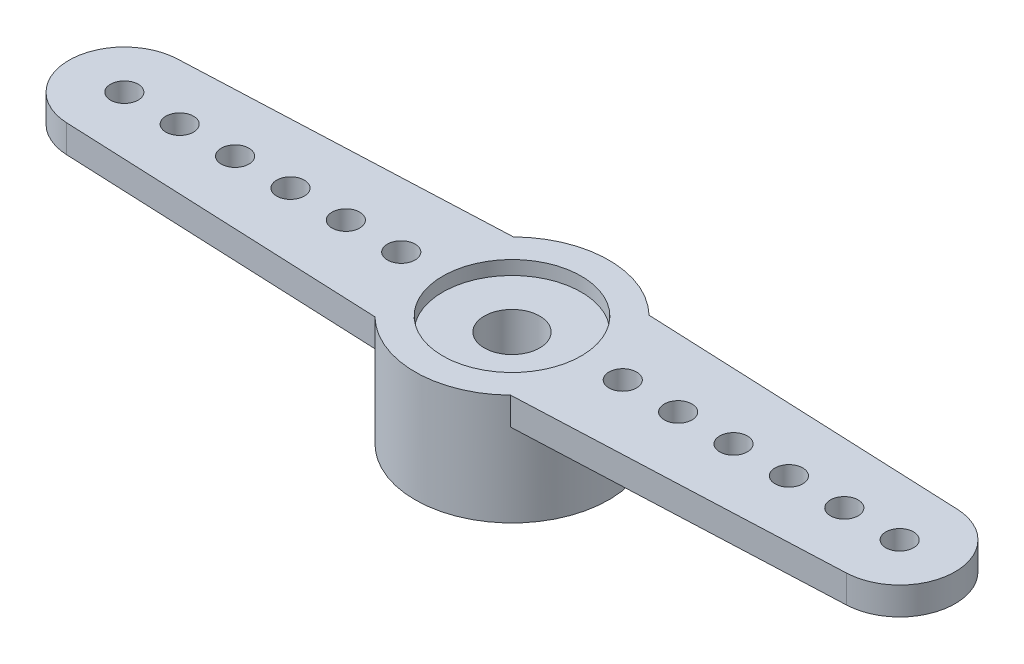
from build123d import *

# Parameters (mm, degrees)
SKETCH1_R           = 3.5
SKETCH1_R_2         = 2.5
BOSS_EXTRUDE1_DEPTH = 4
BOSS_EXTRUDE2_START = -2
SKETCH2_R           = 3.5
SKETCH2_R_2         = 1
BOSS_EXTRUDE2_DEPTH = 1.5
BOSS_EXTRUDE3_START = -1
BOSS_EXTRUDE3_DEPTH = 1
CUT_EXTRUDE1_REACH  = 18.86
SKETCH4_R           = 0.5


with BuildPart() as part:
    # Sketch1 → Boss-Extrude1 (new body)
    with BuildSketch(Plane(origin=(0, 0, 0), x_dir=(1, 0, 0), z_dir=(0, 1, 0))):
        with Locations(Location((0, 0, 0), (0, 0, 270))):
            Circle(SKETCH1_R)
        with Locations(Location((0, 0, 0), (0, 0, 270))):
            Circle(SKETCH1_R_2, mode=Mode.SUBTRACT)
    extrude(amount=BOSS_EXTRUDE1_DEPTH)

    # Sketch2 → Boss-Extrude2 (add)
    with BuildSketch(Plane(origin=(0, 4, 0), x_dir=(1, 0, 0), z_dir=(0, 1, 0)).offset(BOSS_EXTRUDE2_START)):
        with Locations(Location((0, 0, 0), (0, 0, 270))):
            Circle(SKETCH2_R)
        with Locations(Location((0, 0, 0), (0, 0, 270))):
            Circle(SKETCH2_R_2, mode=Mode.SUBTRACT)
    extrude(amount=BOSS_EXTRUDE2_DEPTH)

    # Sketch3 → Boss-Extrude3 (add)
    with BuildSketch(Plane(origin=(0, 4, 0), x_dir=(1, 0, 0), z_dir=(0, 1, 0)).offset(BOSS_EXTRUDE3_START)):
        with BuildLine():
            ThreePointArc((-2.449489743, -2.5), (-3.5, 0), (-2.449489743, 2.5))
            Line((-2.449489743, 2.5), (-14.086174253, 1.998142637))
            ThreePointArc((-14.086174253, 1.998142637), (-16, 0), (-14.086174253, -1.998142637))
            Line((-14.086174253, -1.998142637), (-2.449489743, -2.5))
        make_face()
        with BuildLine():
            Line((2.449489743, -2.5), (14.086174253, -1.998142637))
            ThreePointArc((14.086174253, -1.998142637), (16, 0), (14.086174253, 1.998142637))
            Line((14.086174253, 1.998142637), (2.449489743, 2.5))
            ThreePointArc((2.449489743, 2.5), (3.5, 0), (2.449489743, -2.5))
        make_face()
    extrude(amount=BOSS_EXTRUDE3_DEPTH)

    # Sketch4 → Cut-Extrude1 (cut, up to next)
    with BuildSketch(Plane(origin=(0, 4, 0), x_dir=(1, 0, 0), z_dir=(0, 1, 0)), mode=Mode.PRIVATE) as cut_extrude1_sk1:
        with Locations(Location((4, 0, 0), (0, 0, 270))):
            Circle(SKETCH4_R)
    cut_extrude1_tool1 = extrude(cut_extrude1_sk1.sketch, amount=-CUT_EXTRUDE1_REACH, mode=Mode.PRIVATE) & part.part
    # Sketch4 → Cut-Extrude1 (cut, up to next)
    with BuildSketch(Plane(origin=(0, 4, 0), x_dir=(1, 0, 0), z_dir=(0, 1, 0)), mode=Mode.PRIVATE) as cut_extrude1_sk2:
        with Locations(Location((6, 0, 0), (0, 0, 270))):
            Circle(SKETCH4_R)
    cut_extrude1_tool2 = extrude(cut_extrude1_sk2.sketch, amount=-CUT_EXTRUDE1_REACH, mode=Mode.PRIVATE) & part.part
    # Sketch4 → Cut-Extrude1 (cut, up to next)
    with BuildSketch(Plane(origin=(0, 4, 0), x_dir=(1, 0, 0), z_dir=(0, 1, 0)), mode=Mode.PRIVATE) as cut_extrude1_sk3:
        with Locations(Location((8, 0, 0), (0, 0, 270))):
            Circle(SKETCH4_R)
    cut_extrude1_tool3 = extrude(cut_extrude1_sk3.sketch, amount=-CUT_EXTRUDE1_REACH, mode=Mode.PRIVATE) & part.part
    # Sketch4 → Cut-Extrude1 (cut, up to next)
    with BuildSketch(Plane(origin=(0, 4, 0), x_dir=(1, 0, 0), z_dir=(0, 1, 0)), mode=Mode.PRIVATE) as cut_extrude1_sk4:
        with Locations(Location((10, 0, 0), (0, 0, 270))):
            Circle(SKETCH4_R)
    cut_extrude1_tool4 = extrude(cut_extrude1_sk4.sketch, amount=-CUT_EXTRUDE1_REACH, mode=Mode.PRIVATE) & part.part
    # Sketch4 → Cut-Extrude1 (cut, up to next)
    with BuildSketch(Plane(origin=(0, 4, 0), x_dir=(1, 0, 0), z_dir=(0, 1, 0)), mode=Mode.PRIVATE) as cut_extrude1_sk5:
        with Locations(Location((12, 0, 0), (0, 0, 270))):
            Circle(SKETCH4_R)
    cut_extrude1_tool5 = extrude(cut_extrude1_sk5.sketch, amount=-CUT_EXTRUDE1_REACH, mode=Mode.PRIVATE) & part.part
    # Sketch4 → Cut-Extrude1 (cut, up to next)
    with BuildSketch(Plane(origin=(0, 4, 0), x_dir=(1, 0, 0), z_dir=(0, 1, 0)), mode=Mode.PRIVATE) as cut_extrude1_sk6:
        with Locations(Location((14, 0, 0), (0, 0, 270))):
            Circle(SKETCH4_R)
    cut_extrude1_tool6 = extrude(cut_extrude1_sk6.sketch, amount=-CUT_EXTRUDE1_REACH, mode=Mode.PRIVATE) & part.part
    # Sketch4 → Cut-Extrude1 (cut, up to next)
    with BuildSketch(Plane(origin=(0, 4, 0), x_dir=(1, 0, 0), z_dir=(0, 1, 0)), mode=Mode.PRIVATE) as cut_extrude1_sk7:
        with Locations(Location((-14, 0, 0), (0, 0, 270))):
            Circle(SKETCH4_R)
    cut_extrude1_tool7 = extrude(cut_extrude1_sk7.sketch, amount=-CUT_EXTRUDE1_REACH, mode=Mode.PRIVATE) & part.part
    # Sketch4 → Cut-Extrude1 (cut, up to next)
    with BuildSketch(Plane(origin=(0, 4, 0), x_dir=(1, 0, 0), z_dir=(0, 1, 0)), mode=Mode.PRIVATE) as cut_extrude1_sk8:
        with Locations(Location((-12, 0, 0), (0, 0, 270))):
            Circle(SKETCH4_R)
    cut_extrude1_tool8 = extrude(cut_extrude1_sk8.sketch, amount=-CUT_EXTRUDE1_REACH, mode=Mode.PRIVATE) & part.part
    # Sketch4 → Cut-Extrude1 (cut, up to next)
    with BuildSketch(Plane(origin=(0, 4, 0), x_dir=(1, 0, 0), z_dir=(0, 1, 0)), mode=Mode.PRIVATE) as cut_extrude1_sk9:
        with Locations(Location((-10, 0, 0), (0, 0, 270))):
            Circle(SKETCH4_R)
    cut_extrude1_tool9 = extrude(cut_extrude1_sk9.sketch, amount=-CUT_EXTRUDE1_REACH, mode=Mode.PRIVATE) & part.part
    # Sketch4 → Cut-Extrude1 (cut, up to next)
    with BuildSketch(Plane(origin=(0, 4, 0), x_dir=(1, 0, 0), z_dir=(0, 1, 0)), mode=Mode.PRIVATE) as cut_extrude1_sk10:
        with Locations(Location((-8, 0, 0), (0, 0, 270))):
            Circle(SKETCH4_R)
    cut_extrude1_tool10 = extrude(cut_extrude1_sk10.sketch, amount=-CUT_EXTRUDE1_REACH, mode=Mode.PRIVATE) & part.part
    # Sketch4 → Cut-Extrude1 (cut, up to next)
    with BuildSketch(Plane(origin=(0, 4, 0), x_dir=(1, 0, 0), z_dir=(0, 1, 0)), mode=Mode.PRIVATE) as cut_extrude1_sk11:
        with Locations(Location((-6, 0, 0), (0, 0, 270))):
            Circle(SKETCH4_R)
    cut_extrude1_tool11 = extrude(cut_extrude1_sk11.sketch, amount=-CUT_EXTRUDE1_REACH, mode=Mode.PRIVATE) & part.part
    # Sketch4 → Cut-Extrude1 (cut, up to next)
    with BuildSketch(Plane(origin=(0, 4, 0), x_dir=(1, 0, 0), z_dir=(0, 1, 0)), mode=Mode.PRIVATE) as cut_extrude1_sk12:
        with Locations(Location((-4, 0, 0), (0, 0, 359.998928085))):
            Circle(SKETCH4_R)
    cut_extrude1_tool12 = extrude(cut_extrude1_sk12.sketch, amount=-CUT_EXTRUDE1_REACH, mode=Mode.PRIVATE) & part.part
    add(cut_extrude1_tool1.solids().sort_by_distance((4, 4, 0))[0], mode=Mode.SUBTRACT)
    add(cut_extrude1_tool2.solids().sort_by_distance((6, 4, 0))[0], mode=Mode.SUBTRACT)
    add(cut_extrude1_tool3.solids().sort_by_distance((8, 4, 0))[0], mode=Mode.SUBTRACT)
    add(cut_extrude1_tool4.solids().sort_by_distance((10, 4, 0))[0], mode=Mode.SUBTRACT)
    add(cut_extrude1_tool5.solids().sort_by_distance((12, 4, 0))[0], mode=Mode.SUBTRACT)
    add(cut_extrude1_tool6.solids().sort_by_distance((14, 4, 0))[0], mode=Mode.SUBTRACT)
    add(cut_extrude1_tool7.solids().sort_by_distance((-14, 4, 0))[0], mode=Mode.SUBTRACT)
    add(cut_extrude1_tool8.solids().sort_by_distance((-12, 4, 0))[0], mode=Mode.SUBTRACT)
    add(cut_extrude1_tool9.solids().sort_by_distance((-10, 4, 0))[0], mode=Mode.SUBTRACT)
    add(cut_extrude1_tool10.solids().sort_by_distance((-8, 4, 0))[0], mode=Mode.SUBTRACT)
    add(cut_extrude1_tool11.solids().sort_by_distance((-6, 4, 0))[0], mode=Mode.SUBTRACT)
    add(cut_extrude1_tool12.solids().sort_by_distance((-4, 4, 0))[0], mode=Mode.SUBTRACT)


solid = part.part
